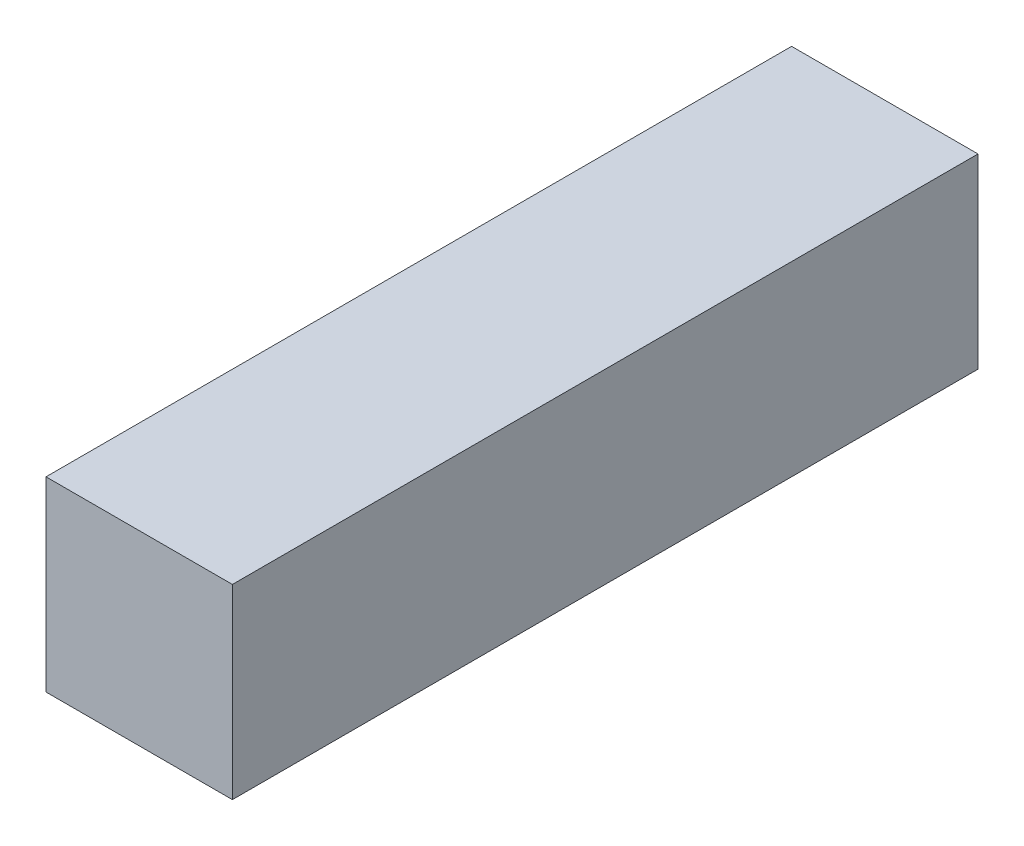
from build123d import *

# Parameters (mm, degrees)
SKETCH1_W           = 6.35
SKETCH1_H           = 6.35
BOSS_EXTRUDE1_DEPTH = 25.4


with BuildPart() as part:
    # Sketch1 → Boss-Extrude1 (new body)
    with BuildSketch(Plane.XY):
        Rectangle(SKETCH1_W, SKETCH1_H)
    extrude(amount=BOSS_EXTRUDE1_DEPTH)


solid = part.part
